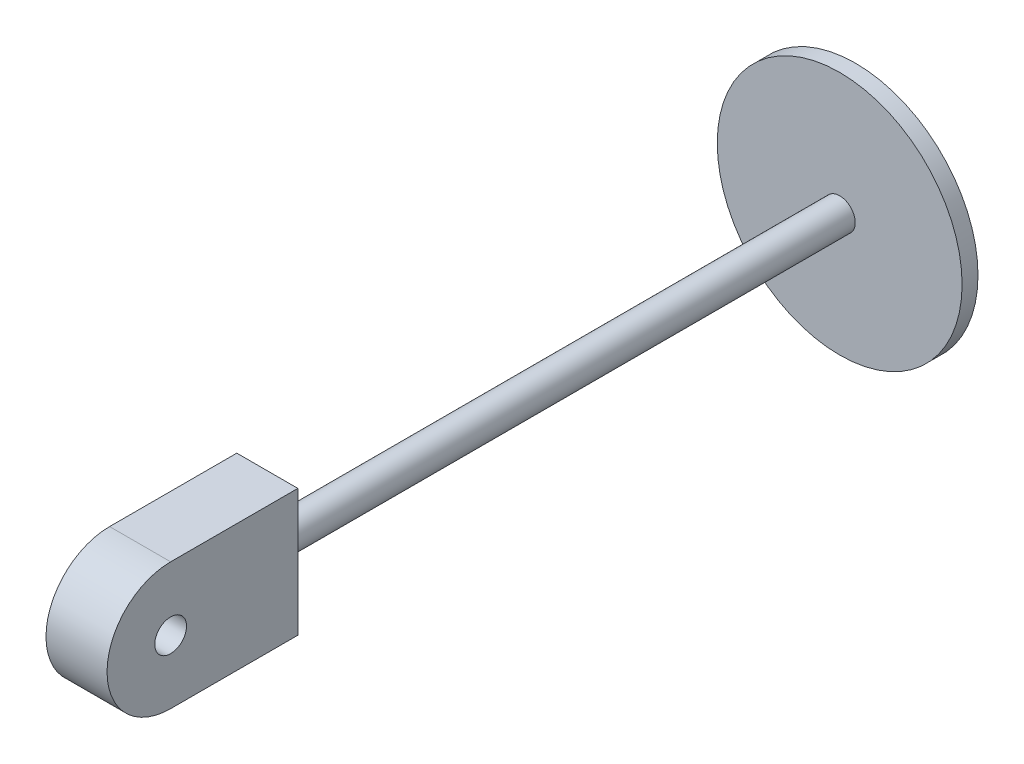
from build123d import *

# Parameters (mm, degrees)
SKETCH1_R           = 9.625
BOSS_EXTRUDE1_DEPTH = 0.625
SKETCH2_R           = 1.225
BOSS_EXTRUDE2_DEPTH = 45
BOSS_EXTRUDE3_DEPTH = 2.4
SKETCH4_R           = 1.25
CUT_EXTRUDE1_DEPTH  = 10


with BuildPart() as part:
    # Sketch1 → Boss-Extrude1 (new, symmetric)
    with BuildSketch(Plane.XY):
        Circle(SKETCH1_R)
    extrude(amount=BOSS_EXTRUDE1_DEPTH, both=True)

    # Sketch2 → Boss-Extrude2 (add)
    with BuildSketch(Plane.XY.offset(0.625)):
        Circle(SKETCH2_R)
    extrude(amount=BOSS_EXTRUDE2_DEPTH)

    # Sketch3 → Boss-Extrude3 (add, symmetric)
    with BuildSketch(Plane(origin=(0, 0, 0), x_dir=(0, 0, -1), z_dir=(1, 0, 0))):
        with BuildLine():
            Line((-45.625, 5), (-45.625, -5))
            Line((-45.625, -5), (-55.625, -5))
            ThreePointArc((-55.625, -5), (-60.625, 0), (-55.625, 5))
            Line((-55.625, 5), (-45.625, 5))
        make_face()
    extrude(amount=BOSS_EXTRUDE3_DEPTH, both=True)

    # Sketch4 → Cut-Extrude1 (cut)
    with BuildSketch(Plane.ZY.offset(2.4)):
        with Locations((55.625, 0)):
            Circle(SKETCH4_R)
    extrude(amount=-CUT_EXTRUDE1_DEPTH, mode=Mode.SUBTRACT)


solid = part.part
